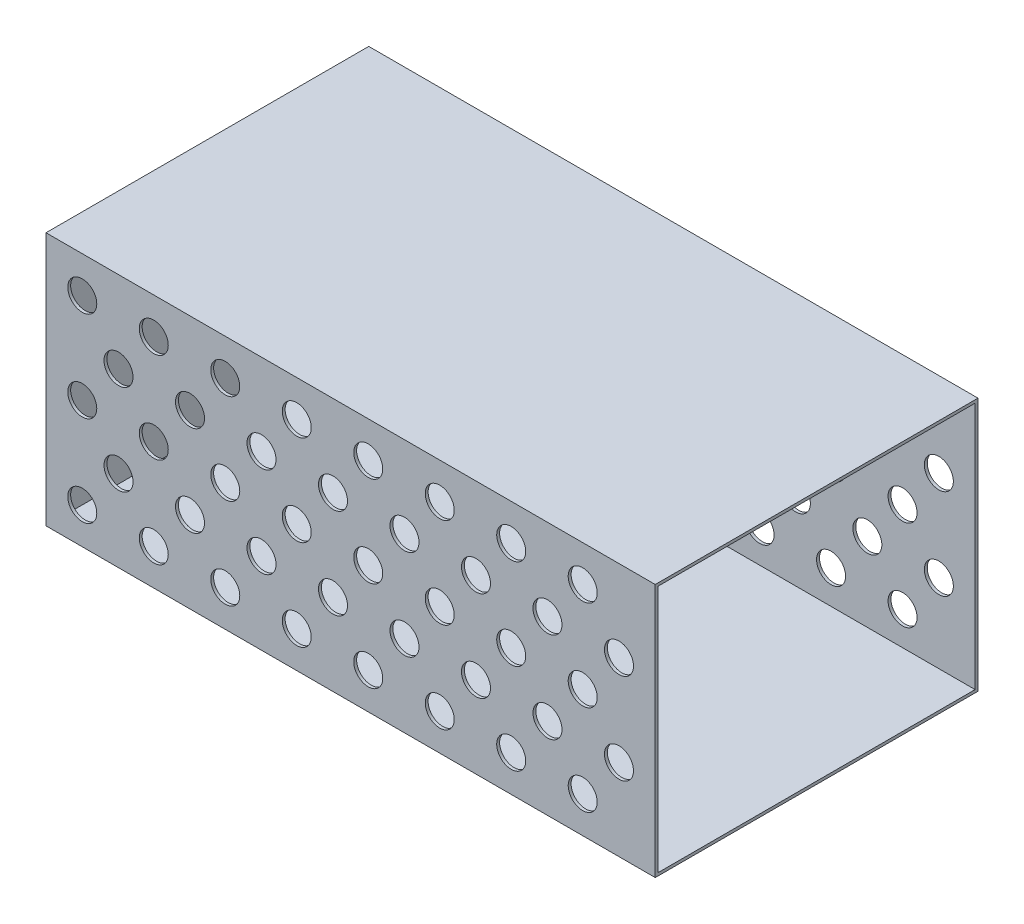
from build123d import *

# Parameters (mm, degrees)
SKETCH1_W             = 168
SKETCH1_H             = 89
BOSS_EXTRUDE1_DEPTH   = 70
SHELL1_T              = -0.8
F_8_0MM_DOWEL_HOLE1_D = 8


with BuildPart() as part:
    # Sketch1 → Boss-Extrude1 (new body)
    with BuildSketch(Plane(origin=(0, 0, 0), x_dir=(1, 0, 0), z_dir=(0, 1, 0))):
        Rectangle(SKETCH1_W, SKETCH1_H)
    extrude(amount=BOSS_EXTRUDE1_DEPTH)

    # Shell1
    shell1_openings = [part.faces().sort_by_distance(p)[0] for p in [
        (84, 35, 0),
    ]]
    offset(amount=SHELL1_T, openings=shell1_openings, kind=Kind.INTERSECTION)

    # Ø8.0mm Dowel Hole1 (through all)
    with Locations(Plane.XY.offset(44.5)):
        with Locations((64, 10), (-74, 60), (-64, 47.5), (-74, 35), (-64, 22.5), (-74, 10), (-54.285714286, 60), (-44.285714286, 47.5), (-54.285714286, 35), (-44.285714286, 22.5), (-54.285714286, 10), (-34.571428571, 60), (-24.571428571, 47.5), (-34.571428571, 35), (-24.571428571, 22.5), (-34.571428571, 10), (-14.857142857, 60), (-4.857142857, 47.5), (-14.857142857, 35), (-4.857142857, 22.5), (-14.857142857, 10), (4.857142857, 60), (14.857142857, 47.5), (4.857142857, 35), (14.857142857, 22.5), (4.857142857, 10), (24.571428571, 60), (34.571428571, 47.5), (24.571428571, 35), (34.571428571, 22.5), (24.571428571, 10), (44.285714286, 60), (54.285714286, 47.5), (44.285714286, 35), (54.285714286, 22.5), (44.285714286, 10), (64, 60), (74, 47.5), (64, 35), (74, 22.5)):
            Hole(F_8_0MM_DOWEL_HOLE1_D / 2)


solid = part.part
